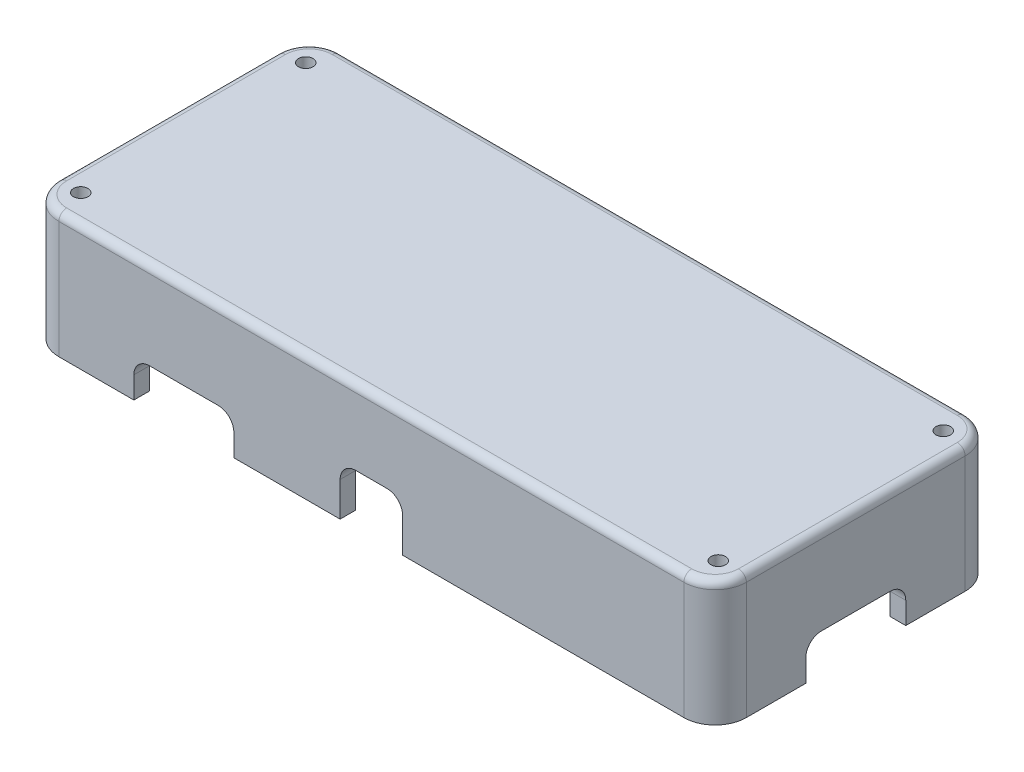
from build123d import *

# Parameters (mm, degrees)
SKETCH1_W             = 139.7
SKETCH1_H             = 57.15
BOSS_EXTRUDE1_DEPTH   = 25.4
FILLET1_R             = 6.35
SKETCH5_W             = 133.35
SKETCH5_H             = 50.8
CUT_EXTRUDE1_DEPTH    = 23.8125
FILLET5_R             = 12.7
F_4_CLEARANCE_HOLE1_D = 2.9464
FILLET6_R             = 1.5875
CUT_EXTRUDE2_REACH    = 146.837
SKETCH6_W             = 20.32
SKETCH6_H             = 7.62
CUT_EXTRUDE3_REACH    = 95.757
SKETCH7_W             = 20.32
SKETCH7_H             = 7.62
CUT_EXTRUDE4_REACH    = 95.757
SKETCH8_W             = 12.7
SKETCH8_H             = 10.16
FILLET7_R             = 3.175
CUT_EXTRUDE5_REACH    = 95.757
SKETCH9_W             = 12.7
SKETCH9_H             = 10.16
FILLET9_R             = 3.175


with BuildPart() as part:
    # Sketch1 → Boss-Extrude1 (new body)
    with BuildSketch(Plane(origin=(0, 0, 0), x_dir=(1, 0, 0), z_dir=(0, 1, 0))):
        Rectangle(SKETCH1_W, SKETCH1_H)
    extrude(amount=BOSS_EXTRUDE1_DEPTH)

    # Fillet1
    fillet1_edges = [part.edges().sort_by_distance(p)[0] for p in [
        (69.85, 12.7, 28.575),
        (-69.85, 12.7, 28.575),
        (-69.85, 12.7, -28.575),
        (69.85, 12.7, -28.575),
    ]]
    fillet(fillet1_edges, radius=FILLET1_R)

    # Sketch5 → Cut-Extrude1 (cut)
    with BuildSketch(Plane.XZ):
        Rectangle(SKETCH5_W, SKETCH5_H)
    extrude(amount=-CUT_EXTRUDE1_DEPTH, mode=Mode.SUBTRACT)

    # Fillet5
    fillet5_edges = [part.edges().sort_by_distance(p)[0] for p in [
        (-66.675, 11.90625, 25.4),
        (66.675, 11.90625, 25.4),
        (66.675, 11.90625, -25.4),
        (-66.675, 11.90625, -25.4),
    ]]
    fillet(fillet5_edges, radius=FILLET5_R)

    # #4 Clearance Hole1 (through all)
    with Locations(Plane(origin=(0, 25.4, 0), x_dir=(-1, 0, 0), z_dir=(0, 1, 0))):
        with Locations((64.77, -22.86), (64.77, 22.86), (-64.77, -22.86), (-64.77, 22.86)):
            Hole(F_4_CLEARANCE_HOLE1_D / 2)

    # Fillet6
    fillet6_edges = [part.edges().sort_by_distance(p)[0] for p in [
        (-69.85, 25.4, 0),
        (0, 25.4, -28.575),
        (69.85, 25.4, 0),
        (0, 25.4, 28.575),
        (-67.990128061, 25.4, 26.715128061),
        (67.990128061, 25.4, 26.715128061),
        (67.990128061, 25.4, -26.715128061),
        (-67.990128061, 25.4, -26.715128061),
    ]]
    fillet(fillet6_edges, radius=FILLET6_R)

    # Sketch6 → Cut-Extrude2 (cut, up to next)
    with BuildSketch(Plane(origin=(69.85, 0, 0), x_dir=(0, 0, -1), z_dir=(1, 0, 0)), mode=Mode.PRIVATE) as cut_extrude2_sk1:
        with Locations((0, 3.81)):
            Rectangle(SKETCH6_W, SKETCH6_H)
    cut_extrude2_tool1 = extrude(cut_extrude2_sk1.sketch, amount=-CUT_EXTRUDE2_REACH, mode=Mode.PRIVATE) & part.part
    add(cut_extrude2_tool1.solids().sort_by_distance((69.85, 3.81, 0))[0], mode=Mode.SUBTRACT)

    # Sketch7 → Cut-Extrude3 (cut, up to next)
    with BuildSketch(Plane.XY.offset(28.575), mode=Mode.PRIVATE) as cut_extrude3_sk1:
        with Locations((-38.1, 3.81)):
            Rectangle(SKETCH7_W, SKETCH7_H)
    cut_extrude3_tool1 = extrude(cut_extrude3_sk1.sketch, amount=-CUT_EXTRUDE3_REACH, mode=Mode.PRIVATE) & part.part
    add(cut_extrude3_tool1.solids().sort_by_distance((-38.1, 3.81, 28.575))[0], mode=Mode.SUBTRACT)

    # Sketch8 → Cut-Extrude4 (cut, up to next)
    with BuildSketch(Plane(origin=(0, 0, -28.575), x_dir=(-1, 0, 0), z_dir=(0, 0, -1)), mode=Mode.PRIVATE) as cut_extrude4_sk1:
        with Locations((-49.53, 5.08)):
            Rectangle(SKETCH8_W, SKETCH8_H)
    cut_extrude4_tool1 = extrude(cut_extrude4_sk1.sketch, amount=-CUT_EXTRUDE4_REACH, mode=Mode.PRIVATE) & part.part
    add(cut_extrude4_tool1.solids().sort_by_distance((49.53, 5.08, -28.575))[0], mode=Mode.SUBTRACT)

    # Fillet7
    fillet7_edges = [part.edges().sort_by_distance(p)[0] for p in [
        (68.2625, 7.62, -10.16),
        (68.2625, 7.62, 10.16),
        (-27.94, 7.62, 26.9875),
        (-48.26, 7.62, 26.9875),
        (43.18, 10.16, -26.9875),
        (55.88, 10.16, -26.915656079),
    ]]
    fillet(fillet7_edges, radius=FILLET7_R)

    # Sketch9 → Cut-Extrude5 (cut, up to next)
    with BuildSketch(Plane.XY.offset(28.575), mode=Mode.PRIVATE) as cut_extrude5_sk1:
        with Locations((0, 5.08)):
            Rectangle(SKETCH9_W, SKETCH9_H)
    cut_extrude5_tool1 = extrude(cut_extrude5_sk1.sketch, amount=-CUT_EXTRUDE5_REACH, mode=Mode.PRIVATE) & part.part
    cut_extrude5 = cut_extrude5_tool1.solids().sort_by_distance((0, 5.08, 28.575))[0]
    add(cut_extrude5, mode=Mode.SUBTRACT)

    # Mirror1: Cut-Extrude5 across plane
    add(cut_extrude5.mirror(Plane.XY), mode=Mode.SUBTRACT)

    # Fillet9
    fillet9_edges = [part.edges().sort_by_distance(p)[0] for p in [
        (6.35, 10.16, 26.9875),
        (-6.35, 10.16, 26.9875),
        (6.35, 10.16, -26.9875),
        (-6.35, 10.16, -26.9875),
    ]]
    fillet(fillet9_edges, radius=FILLET9_R)


solid = part.part
